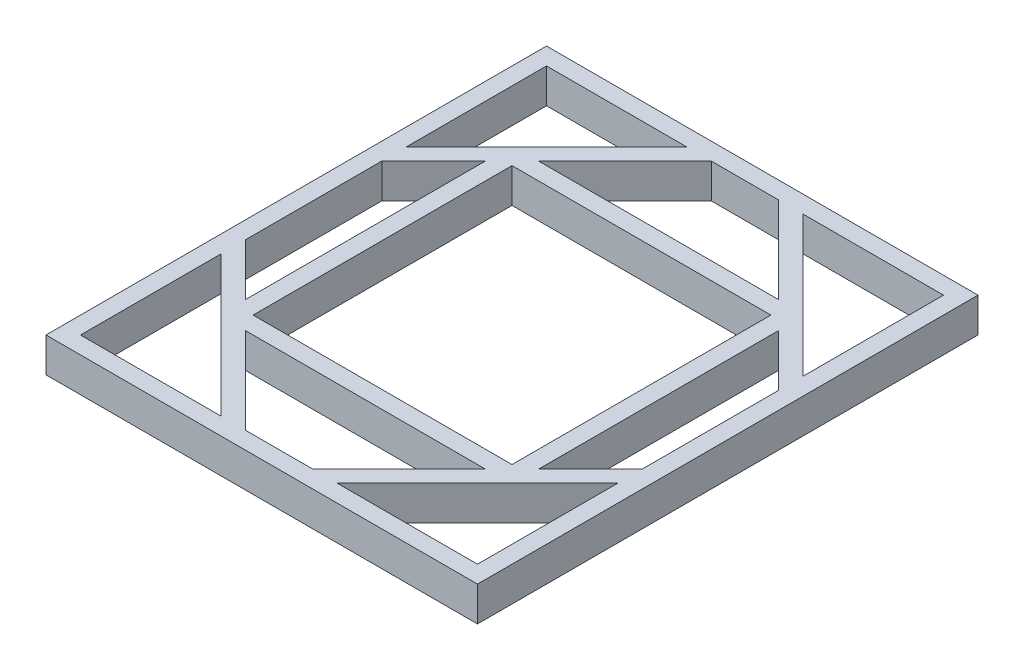
from build123d import *

# Parameters (mm, degrees)
SKETCH1_W           = 635
SKETCH1_H           = 736.6
SKETCH1_W_2         = 584.2
SKETCH1_H_2         = 685.8
BOSS_EXTRUDE1_DEPTH = 50.8


with BuildPart() as part:
    # Sketch1 → Boss-Extrude1 (new body)
    # profile 1 of 13: a face of its own
    with BuildSketch(Plane(origin=(0, 0, 0), x_dir=(1, 0, 0), z_dir=(0, 1, 0))):
        Rectangle(SKETCH1_W, SKETCH1_H)
        Rectangle(SKETCH1_W_2, SKETCH1_H_2, mode=Mode.SUBTRACT)
    # profile 2 of 13: a face of its own
    with BuildSketch(Plane(origin=(0, 0, 0), x_dir=(1, 0, 0), z_dir=(0, 1, 0))):
        Polygon((176.657, -215.876084731), (49.633084731, -342.9), (85.554109215, -342.9), (292.1, -136.354109215), (292.1, -100.433084731), (215.9, -176.633084731), (202.057, -190.476084731), (190.5, -202.033084731), align=None)
    # profile 3 of 13: a face of its own
    with BuildSketch(Plane(origin=(0, 0, 0), x_dir=(1, 0, 0), z_dir=(0, 1, 0))):
        Polygon((85.554109215, 342.9), (49.633084731, 342.9), (176.657, 215.876084731), (190.5, 202.033084731), (202.057, 190.476084731), (215.9, 176.633084731), (292.1, 100.433084731), (292.1, 136.354109215), align=None)
    # profile 4 of 13: a face of its own
    with BuildSketch(Plane(origin=(0, 0, 0), x_dir=(1, 0, 0), z_dir=(0, 1, 0))):
        Polygon((-85.554109215, 342.9), (-292.1, 136.354109215), (-292.1, 100.433084731), (-215.9, 176.633084731), (-202.057, 190.476084731), (-190.5, 202.033084731), (-176.657, 215.876084731), (-49.633084731, 342.9), align=None)
    # profile 5 of 13: a face of its own
    with BuildSketch(Plane(origin=(0, 0, 0), x_dir=(1, 0, 0), z_dir=(0, 1, 0))):
        Polygon((-215.9, -176.633084731), (-292.1, -100.433084731), (-292.1, -136.354109215), (-85.554109215, -342.9), (-49.633084731, -342.9), (-176.657, -215.876084731), (-190.5, -202.033084731), (-202.057, -190.476084731), align=None)
    # profile 6 of 13: a face of its own
    with BuildSketch(Plane(origin=(0, 0, 0), x_dir=(1, 0, 0), z_dir=(0, 1, 0))):
        Polygon((176.657, 215.876084731), (-176.657, 215.876084731), (-190.5, 202.033084731), (-190.5, 190.476084731), (190.5, 190.476084731), (190.5, 202.033084731), align=None)
    # profile 7 of 13: a face of its own
    with BuildSketch(Plane(origin=(0, 0, 0), x_dir=(1, 0, 0), z_dir=(0, 1, 0))):
        Polygon((-202.057, 190.476084731), (-215.9, 176.633084731), (-215.9, -176.633084731), (-202.057, -190.476084731), (-190.5, -190.476084731), (-190.5, 190.476084731), align=None)
    # profile 8 of 13: a face of its own
    with BuildSketch(Plane(origin=(0, 0, 0), x_dir=(1, 0, 0), z_dir=(0, 1, 0))):
        Polygon((202.057, 190.476084731), (190.5, 190.476084731), (190.5, -190.476084731), (202.057, -190.476084731), (215.9, -176.633084731), (215.9, 176.633084731), align=None)
    # profile 9 of 13: a face of its own
    with BuildSketch(Plane(origin=(0, 0, 0), x_dir=(1, 0, 0), z_dir=(0, 1, 0))):
        Polygon((-190.5, -190.476084731), (-190.5, -202.033084731), (-176.657, -215.876084731), (176.657, -215.876084731), (190.5, -202.033084731), (190.5, -190.476084731), align=None)
    # profile 10 of 13: a face of its own
    with BuildSketch(Plane(origin=(0, 0, 0), x_dir=(1, 0, 0), z_dir=(0, 1, 0))):
        Polygon((-190.5, 202.033084731), (-202.057, 190.476084731), (-190.5, 190.476084731), align=None)
    # profile 11 of 13: a face of its own
    with BuildSketch(Plane(origin=(0, 0, 0), x_dir=(1, 0, 0), z_dir=(0, 1, 0))):
        Polygon((-190.5, -190.476084731), (-202.057, -190.476084731), (-190.5, -202.033084731), align=None)
    # profile 12 of 13: a face of its own
    with BuildSketch(Plane(origin=(0, 0, 0), x_dir=(1, 0, 0), z_dir=(0, 1, 0))):
        Polygon((202.057, -190.476084731), (190.5, -190.476084731), (190.5, -202.033084731), align=None)
    # profile 13 of 13: a face of its own
    with BuildSketch(Plane(origin=(0, 0, 0), x_dir=(1, 0, 0), z_dir=(0, 1, 0))):
        Polygon((202.057, 190.476084731), (190.5, 202.033084731), (190.5, 190.476084731), align=None)
    extrude(amount=BOSS_EXTRUDE1_DEPTH)


solid = part.part
